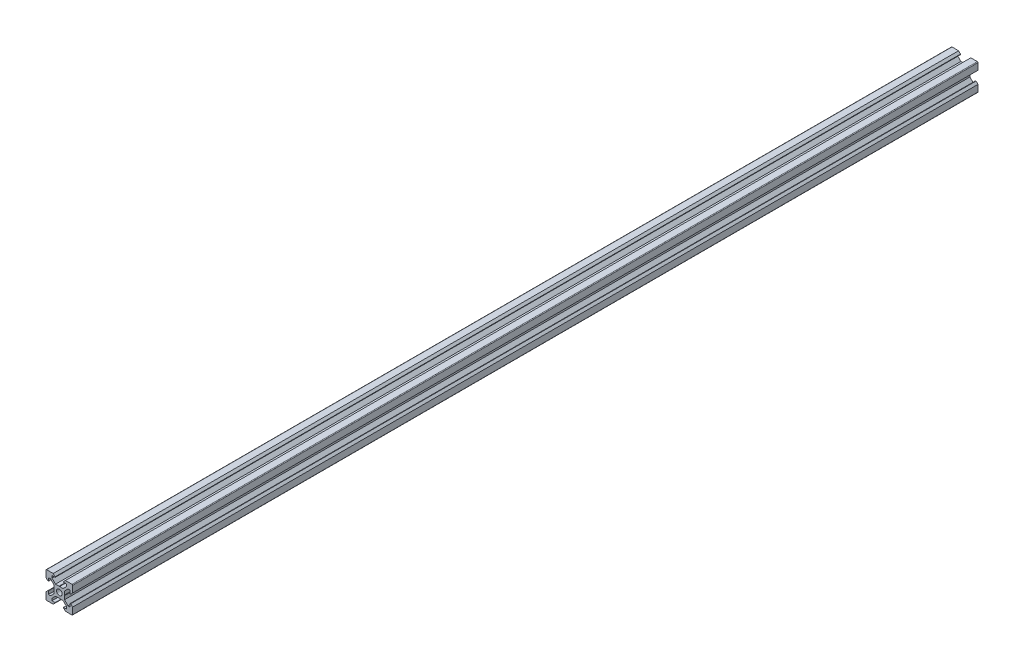
from build123d import *

# Parameters (mm, degrees)
SKETCH1_R           = 2.1
BOSS_EXTRUDE1_DEPTH = 680


with BuildPart() as part:
    # Sketch1 → Boss-Extrude1 (new body)
    with BuildSketch(Plane.XY):
        with BuildLine():
            Line((4.58, -10), (9.5, -10))
            ThreePointArc((9.5, -10), (9.853553391, -9.853553391), (10, -9.5))
            Line((10, -9.5), (10, -4.58))
            Line((10, -4.58), (8.545, -3.125))
            Line((8.545, -3.125), (8.2, -3.125))
            Line((8.2, -3.125), (8.2, -5.5))
            Line((8.2, -5.5), (6.560660172, -5.5))
            Line((6.560660172, -5.5), (3.9, -2.839339828))
            Line((3.9, -2.839339828), (3.9, -0.21))
            Line((3.9, -0.21), (3.69, 0))
            Line((3.69, 0), (3.9, 0.21))
            Line((3.9, 0.21), (3.9, 2.839339828))
            Line((3.9, 2.839339828), (6.560660172, 5.5))
            Line((6.560660172, 5.5), (8.2, 5.5))
            Line((8.2, 5.5), (8.2, 3.125))
            Line((8.2, 3.125), (8.545, 3.125))
            Line((8.545, 3.125), (10, 4.58))
            Line((10, 4.58), (10, 9.5))
            ThreePointArc((10, 9.5), (9.853553391, 9.853553391), (9.5, 10))
            Line((9.5, 10), (4.58, 10))
            Line((4.58, 10), (3.125, 8.545))
            Line((3.125, 8.545), (3.125, 8.2))
            Line((3.125, 8.2), (5.5, 8.2))
            Line((5.5, 8.2), (5.5, 6.560660172))
            Line((5.5, 6.560660172), (2.839339828, 3.9))
            Line((2.839339828, 3.9), (0.21, 3.9))
            Line((0.21, 3.9), (0, 3.69))
            Line((0, 3.69), (-0.21, 3.9))
            Line((-0.21, 3.9), (-2.839339828, 3.9))
            Line((-2.839339828, 3.9), (-5.5, 6.560660172))
            Line((-5.5, 6.560660172), (-5.5, 8.2))
            Line((-5.5, 8.2), (-3.125, 8.2))
            Line((-3.125, 8.2), (-3.125, 8.545))
            Line((-3.125, 8.545), (-4.58, 10))
            Line((-4.58, 10), (-9.5, 10))
            ThreePointArc((-9.5, 10), (-9.853553391, 9.853553391), (-10, 9.5))
            Line((-10, 9.5), (-10, 4.58))
            Line((-10, 4.58), (-8.545, 3.125))
            Line((-8.545, 3.125), (-8.2, 3.125))
            Line((-8.2, 3.125), (-8.2, 5.5))
            Line((-8.2, 5.5), (-6.560660172, 5.5))
            Line((-6.560660172, 5.5), (-3.9, 2.839339828))
            Line((-3.9, 2.839339828), (-3.9, 0.21))
            Line((-3.9, 0.21), (-3.69, 0))
            Line((-3.69, 0), (-3.9, -0.21))
            Line((-3.9, -0.21), (-3.9, -2.839339828))
            Line((-3.9, -2.839339828), (-6.560660172, -5.5))
            Line((-6.560660172, -5.5), (-8.2, -5.5))
            Line((-8.2, -5.5), (-8.2, -3.125))
            Line((-8.2, -3.125), (-8.545, -3.125))
            Line((-8.545, -3.125), (-10, -4.58))
            Line((-10, -4.58), (-10, -9.5))
            ThreePointArc((-10, -9.5), (-9.853553391, -9.853553391), (-9.5, -10))
            Line((-9.5, -10), (-4.58, -10))
            Line((-4.58, -10), (-3.125, -8.545))
            Line((-3.125, -8.545), (-3.125, -8.2))
            Line((-3.125, -8.2), (-5.5, -8.2))
            Line((-5.5, -8.2), (-5.5, -6.560660172))
            Line((-5.5, -6.560660172), (-2.839339828, -3.9))
            Line((-2.839339828, -3.9), (-0.21, -3.9))
            Line((-0.21, -3.9), (0, -3.69))
            Line((0, -3.69), (0.21, -3.9))
            Line((0.21, -3.9), (2.839339828, -3.9))
            Line((2.839339828, -3.9), (5.5, -6.560660172))
            Line((5.5, -6.560660172), (5.5, -8.2))
            Line((5.5, -8.2), (3.125, -8.2))
            Line((3.125, -8.2), (3.125, -8.545))
            Line((3.125, -8.545), (4.58, -10))
        make_face()
        Circle(SKETCH1_R, mode=Mode.SUBTRACT)
    extrude(amount=BOSS_EXTRUDE1_DEPTH)


solid = part.part
